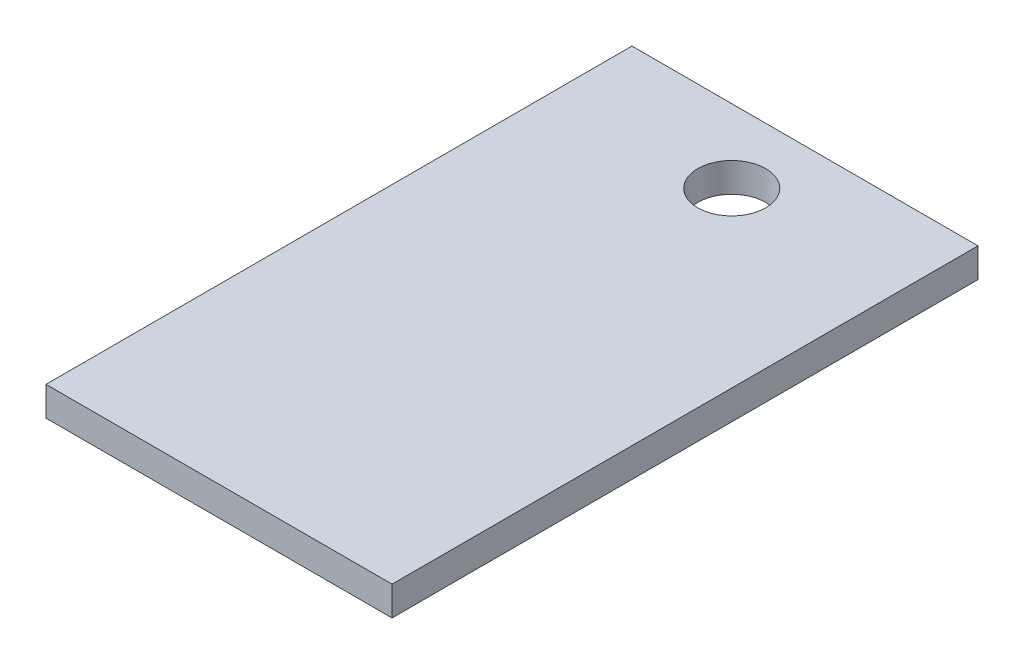
from build123d import *

# Parameters (mm, degrees)
SKETCH1_W           = 15
SKETCH1_H           = 25.4
SKETCH1_R           = 1.4732
BOSS_EXTRUDE1_DEPTH = 1.27


with BuildPart() as part:
    # Sketch1 → Boss-Extrude1 (new body)
    with BuildSketch(Plane(origin=(0, 0, 0), x_dir=(1, 0, 0), z_dir=(0, 1, 0))):
        with Locations((7.5, -12.7)):
            Rectangle(SKETCH1_W, SKETCH1_H)
        with Locations(Location((7.5, -3.175, 0), (0, 0, 270))):
            Circle(SKETCH1_R, mode=Mode.SUBTRACT)
    extrude(amount=BOSS_EXTRUDE1_DEPTH)


solid = part.part
